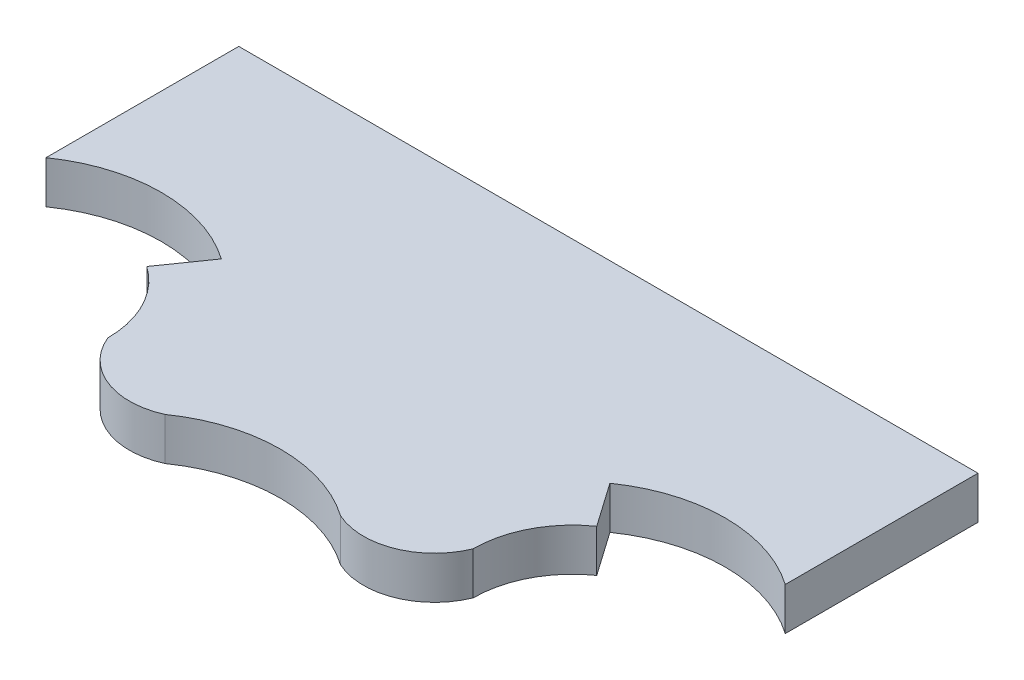
from build123d import *

# Parameters (mm, degrees)
BOSS_EXTRUDE1_DEPTH = 3


with BuildPart() as part:
    # Sketch2 → Boss-Extrude1 (new body)
    with BuildSketch(Plane(origin=(0, 0, 0), x_dir=(1, 0, 0), z_dir=(0, 1, 0))):
        with BuildLine():
            Line((-15.860247962, 17.20906431), (-13.694996915, 20.301363277))
            ThreePointArc((-13.694996915, 20.301363277), (-19.875283017, 22.25), (-26.055569119, 20.301363277))
            Line((-26.055569119, 20.301363277), (-26.055569119, 33.889213566))
            Line((-26.055569119, 33.889213566), (26.055569119, 33.889213566))
            Line((26.055569119, 33.889213566), (26.055569119, 20.301363277))
            ThreePointArc((26.055569119, 20.301363277), (19.875283017, 22.25), (13.694996915, 20.301363277))
            Line((13.694996915, 20.301363277), (15.860247962, 17.20906431))
            ThreePointArc((15.860247962, 17.20906431), (13.666207185, 14.707240293), (12.875283017, 11.475))
            ThreePointArc((12.875283017, 11.475), (10.090653959, 8.727908609), (6.180286102, 8.826363277))
            ThreePointArc((6.180286102, 8.826363277), (0, 10.775), (-6.180286102, 8.826363277))
            ThreePointArc((-6.180286102, 8.826363277), (-10.090653959, 8.727908609), (-12.875283017, 11.475))
            ThreePointArc((-12.875283017, 11.475), (-13.666207185, 14.707240293), (-15.860247962, 17.20906431))
        make_face()
    extrude(amount=BOSS_EXTRUDE1_DEPTH)


solid = part.part
